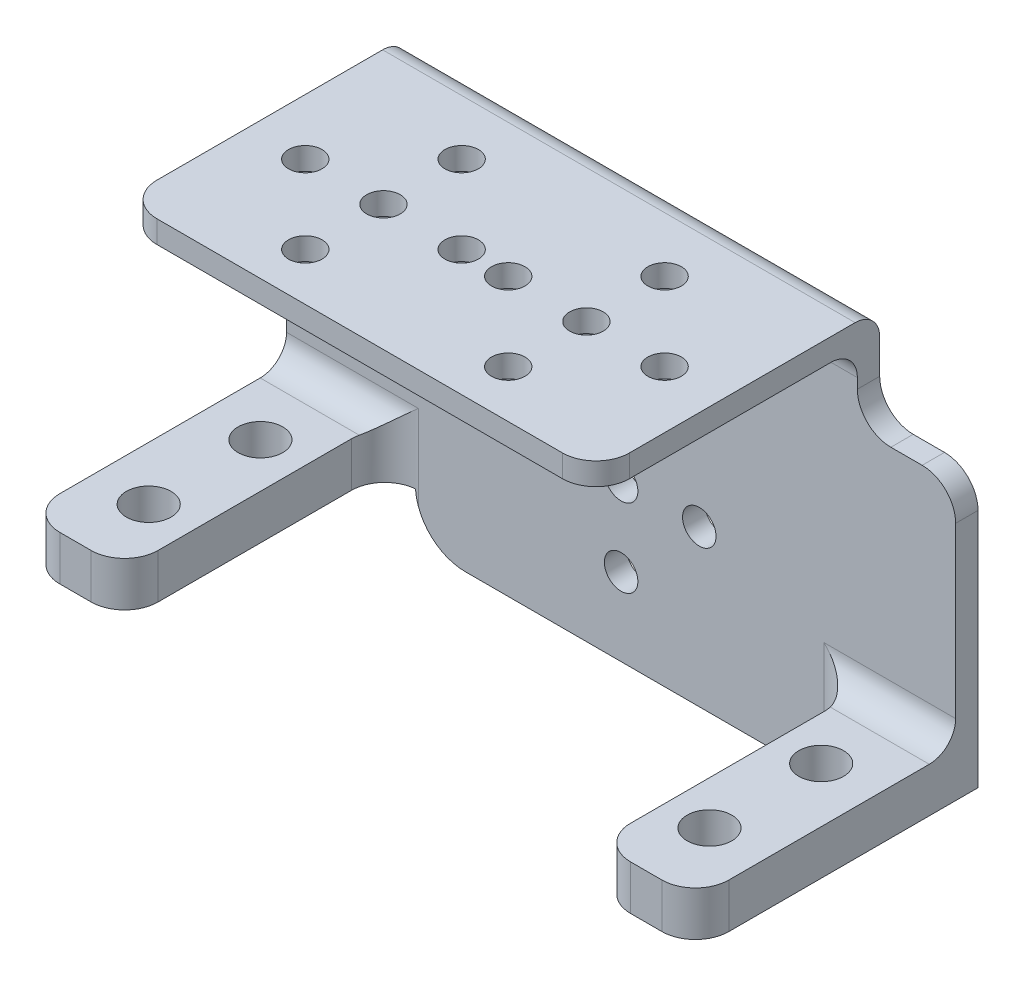
from build123d import *

# Parameters (mm, degrees)
BOSS_EXTRUDE1_DEPTH = 2
SKETCH1_3_W         = 42.3
SKETCH1_3_H         = 2
BOSS_EXTRUDE2_DEPTH = 25.4
SKETCH1_4_W         = 8.8
SKETCH1_4_H         = 4
BOSS_EXTRUDE3_DEPTH = 25.3
FILLET31_R          = 3
FILLET32_R          = 2.36
FILLET26_R          = 2.2
SKETCH2_R           = 2
CUT_EXTRUDE1_DEPTH  = 10
SKETCH3_R           = 1.5
CUT_EXTRUDE2_DEPTH  = 10
SKETCH4_R           = 1.5
CUT_EXTRUDE3_DEPTH  = 10


with BuildPart() as part:
    # Sketch1 → Boss-Extrude1 (new body)
    with BuildSketch(Plane.XY):
        with BuildLine():
            Line((21.15, 16.48), (-21.15, 16.48))
            Line((-21.15, 16.48), (-21.15, 10.22))
            Line((-21.15, 10.22), (-29.95, 10.22))
            Line((-29.95, 10.22), (-29.95, -10.28))
            Line((-29.95, -10.28), (-21.15, -10.28))
            Line((-21.15, -10.28), (-21.15, -14.28))
            Line((-21.15, -14.28), (-18.393508768, -14.28))
            ThreePointArc((-18.393508768, -14.28), (-17.013522556, -17.263290244), (-13.96, -18.48))
            Line((-13.96, -18.48), (13.96, -18.48))
            ThreePointArc((13.96, -18.48), (17.013522556, -17.263290244), (18.393508768, -14.28))
            Line((18.393508768, -14.28), (21.15, -14.28))
            Line((21.15, -14.28), (21.15, -10.28))
            Line((21.15, -10.28), (29.95, -10.28))
            Line((29.95, -10.28), (29.95, 10.22))
            Line((29.95, 10.22), (21.15, 10.22))
            Line((21.15, 10.22), (21.15, 16.48))
        make_face()
    extrude(amount=BOSS_EXTRUDE1_DEPTH)

    # Sketch1<3> → Boss-Extrude2 (add)
    with BuildSketch(Plane.XY):
        with Locations((0, 17.48)):
            Rectangle(SKETCH1_3_W, SKETCH1_3_H)
    extrude(amount=BOSS_EXTRUDE2_DEPTH)

    # Sketch1<4> → Boss-Extrude3 (add)
    with BuildSketch(Plane.XY):
        with Locations((-25.55, -12.28)):
            Rectangle(SKETCH1_4_W, SKETCH1_4_H)
        with Locations((25.55, -12.28)):
            Rectangle(SKETCH1_4_W, SKETCH1_4_H)
    extrude(amount=BOSS_EXTRUDE3_DEPTH)

    # Fillet31
    fillet31_edges = [part.edges().sort_by_distance(p)[0] for p in [
        (21.15, -12.28, 25.3),
        (29.95, -12.28, 25.3),
        (21.15, 17.48, 25.4),
        (-21.15, 17.48, 25.4),
        (-29.95, -12.28, 25.3),
        (-21.15, -12.28, 25.3),
        (-29.95, 10.22, 1),
        (-21.15, 10.22, 1),
        (21.15, 10.22, 1),
        (29.95, 10.22, 1),
        (21.15, -12.28, 2),
        (-21.15, -12.28, 2),
    ]]
    fillet(fillet31_edges, radius=FILLET31_R)

    # Fillet32
    fillet32_edges = [part.edges().sort_by_distance(p)[0] for p in [
        (24.05, -10.28, 2),
        (-24.05, -10.28, 2),
        (0, 16.48, 2),
    ]]
    fillet(fillet32_edges, radius=FILLET32_R)

    # Fillet26
    fillet26_edges = [part.edges().sort_by_distance(p)[0] for p in [
        (0, 18.48, 0),
    ]]
    fillet(fillet26_edges, radius=FILLET26_R)

    # Sketch2 → Cut-Extrude1 (cut, symmetric)
    with BuildSketch(Plane.XZ.offset(14.28)):
        with Locations((25.05, 19.14)):
            Circle(SKETCH2_R)
        with Locations((25.05, 9.14)):
            Circle(SKETCH2_R)
        with Locations((-25.15, 19.14)):
            Circle(SKETCH2_R)
        with Locations((-25.15, 9.14)):
            Circle(SKETCH2_R)
    extrude(amount=CUT_EXTRUDE1_DEPTH, both=True, mode=Mode.SUBTRACT)

    # Sketch3 → Cut-Extrude2 (cut)
    with BuildSketch(Plane(origin=(0, 18.48, 0), x_dir=(1, 0, 0), z_dir=(0, 1, 0))):
        with Locations((-9.134575671, -14.14)):
            Circle(SKETCH3_R)
        with Locations((-9.134575671, -7.14)):
            Circle(SKETCH3_R)
        with Locations((-2.134575671, -14.14)):
            Circle(SKETCH3_R)
        with Locations((-9.134575671, -21.14)):
            Circle(SKETCH3_R)
        with Locations((-16.134575671, -14.14)):
            Circle(SKETCH3_R)
        with Locations((9.034575671, -14.14)):
            Circle(SKETCH3_R)
        with Locations((9.034575671, -7.14)):
            Circle(SKETCH3_R)
        with Locations((16.034575671, -14.14)):
            Circle(SKETCH3_R)
        with Locations((9.034575671, -21.14)):
            Circle(SKETCH3_R)
        with Locations((2.034575671, -14.14)):
            Circle(SKETCH3_R)
    extrude(amount=-CUT_EXTRUDE2_DEPTH, mode=Mode.SUBTRACT)

    # Sketch4 → Cut-Extrude3 (cut)
    with BuildSketch(Plane(origin=(0, 0, 0), x_dir=(-1, 0, 0), z_dir=(0, 0, -1))):
        with Locations((0, 2.48)):
            Circle(SKETCH4_R)
        with Locations((0, -4.52)):
            Circle(SKETCH4_R)
        with Locations((0, -11.52)):
            Circle(SKETCH4_R)
        with Locations((7, -4.52)):
            Circle(SKETCH4_R)
        with Locations((-7, -4.52)):
            Circle(SKETCH4_R)
    extrude(amount=-CUT_EXTRUDE3_DEPTH, mode=Mode.SUBTRACT)


solid = part.part
